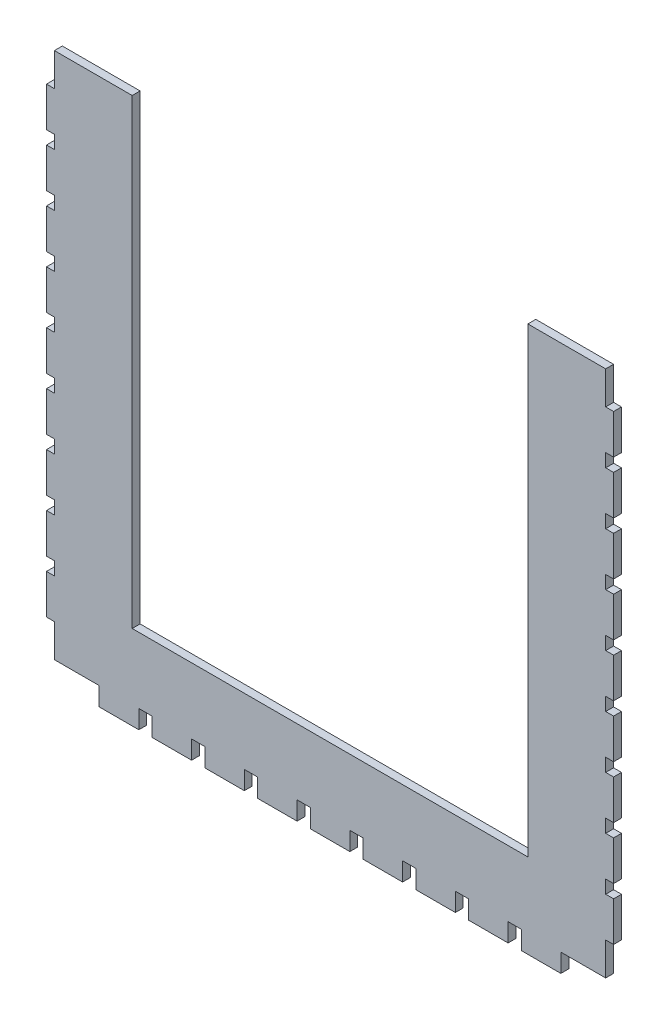
from build123d import *

# Parameters (mm, degrees)
BOSS_EXTRUDE1_DEPTH = 3


with BuildPart() as part:
    # Sketch1 → Boss-Extrude1 (new body)
    with BuildSketch(Plane.XY):
        Polygon((-75, 100), (-104.5, 100), (-104.5, 87.5), (-107.5, 87.5), (-107.5, 72.5), (-104.5, 72.5), (-104.5, 67.5), (-107.5, 67.5), (-107.5, 52.5), (-104.5, 52.5), (-104.5, 47.5), (-107.5, 47.5), (-107.5, 32.5), (-104.5, 32.5), (-104.5, 27.5), (-107.5, 27.5), (-107.5, 12.5), (-104.5, 12.5), (-104.5, 7.5), (-107.5, 7.5), (-107.5, -7.5), (-104.5, -7.5), (-104.5, -12.5), (-107.5, -12.5), (-107.5, -27.5), (-104.5, -27.5), (-104.5, -32.5), (-107.5, -32.5), (-107.5, -47.5), (-104.5, -47.5), (-104.5, -52.5), (-107.5, -52.5), (-107.5, -67.5), (-104.5, -67.5), (-104.5, -72.5), (-107.5, -72.5), (-107.5, -87.5), (-104.5, -87.5), (-104.5, -100), (-87.5, -100), (-87.5, -107), (-72.5, -107), (-72.5, -100), (-67.5, -100), (-67.5, -107), (-52.5, -107), (-52.5, -100), (-47.5, -100), (-47.5, -107), (-32.5, -107), (-32.5, -100), (-27.5, -100), (-27.5, -107), (-12.5, -107), (-12.5, -100), (-7.5, -100), (-7.5, -107), (7.5, -107), (7.5, -100), (12.5, -100), (12.5, -107), (27.5, -107), (27.5, -100), (32.5, -100), (32.5, -107), (47.5, -107), (47.5, -100), (52.5, -100), (52.5, -107), (67.5, -107), (67.5, -100), (72.5, -100), (72.5, -107), (87.5, -107), (87.5, -100), (104.5, -100), (104.5, -87.5), (107.5, -87.5), (107.5, -72.5), (104.5, -72.5), (104.5, -67.5), (107.5, -67.5), (107.5, -52.5), (104.5, -52.5), (104.5, -47.5), (107.5, -47.5), (107.5, -32.5), (104.5, -32.5), (104.5, -27.5), (107.5, -27.5), (107.5, -12.5), (104.5, -12.5), (104.5, -7.5), (107.5, -7.5), (107.5, 7.5), (104.5, 7.5), (104.5, 12.5), (107.5, 12.5), (107.5, 27.5), (104.5, 27.5), (104.5, 32.5), (107.5, 32.5), (107.5, 47.5), (104.5, 47.5), (104.5, 52.5), (107.5, 52.5), (107.5, 67.5), (104.5, 67.5), (104.5, 72.5), (107.5, 72.5), (107.5, 87.5), (104.5, 87.5), (104.5, 100), (75, 100), (75, -75), (-75, -75), align=None)
    extrude(amount=BOSS_EXTRUDE1_DEPTH)


solid = part.part
